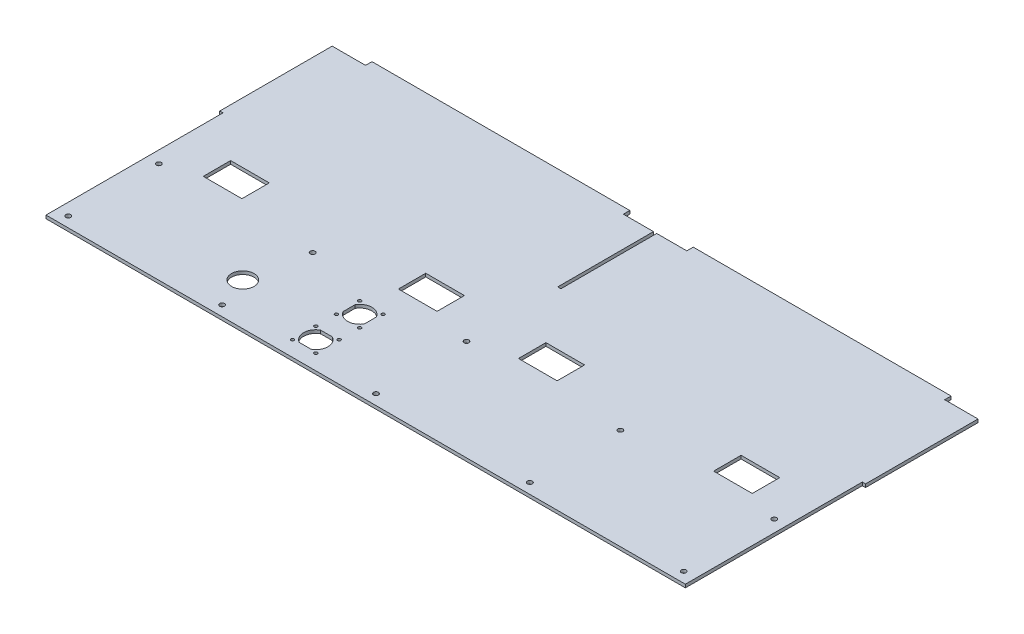
from build123d import *

# Parameters (mm, degrees)
SKETCH1_W            = 629.90984
SKETCH1_H            = 147.69846
BOSS_EXTRUDE1_DEPTH  = 3.175
SKETCH3_W            = 254
SKETCH3_H            = 3.175
BOSS_EXTRUDE2_DEPTH  = 6.35
SKETCH4_W            = 3.175
SKETCH4_H            = 188.732840052
CUT_EXTRUDE1_DEPTH   = 3.175
SKETCH6_W            = 3.175
SKETCH6_H            = 110.773845
BOSS_EXTRUDE4_DEPTH  = 3.175
SKETCH8_W            = 629.90984
SKETCH8_H            = 18.04416
BOSS_EXTRUDE5_DEPTH  = 3.175
SKETCH10_W           = 38.1
SKETCH10_H           = 18.04416
SKETCH10_H_2         = 36.08832
CUT_EXTRUDE3_DEPTH   = 652.56536379
BOSS_EXTRUDE6_DEPTH  = 3.175
SKETCH13_R           = 1.55
SKETCH13_R_2         = 11.049
CUT_EXTRUDE4_DEPTH   = 652.56536379
M4_CLEARANCE_HOLE1_D = 4.8


with BuildPart() as part:
    # Sketch1 → Boss-Extrude1 (new body)
    with BuildSketch(Plane(origin=(0, 0, 0), x_dir=(1, 0, 0), z_dir=(0, 1, 0))):
        with Locations((314.95492, 73.84923)):
            Rectangle(SKETCH1_W, SKETCH1_H)
    extrude(amount=BOSS_EXTRUDE1_DEPTH)

    # Sketch3 → Boss-Extrude2 (add)
    with BuildSketch(Plane(origin=(0, 0, -147.69846), x_dir=(-1, 0, 0), z_dir=(0, 0, -1))):
        with Locations((-473.22613, 1.5875)):
            Rectangle(SKETCH3_W, SKETCH3_H)
        with Locations((-156.68371, 1.5875)):
            Rectangle(SKETCH3_W, SKETCH3_H)
    extrude(amount=BOSS_EXTRUDE2_DEPTH)

    # Sketch4 → Cut-Extrude1 (cut)
    with BuildSketch(Plane(origin=(0, 3.175, 0), x_dir=(1, 0, 0), z_dir=(0, 1, 0))):
        with Locations((314.95492, 147.69846)):
            Rectangle(SKETCH4_W, SKETCH4_H)
    extrude(amount=-CUT_EXTRUDE1_DEPTH, mode=Mode.SUBTRACT)

    # Sketch6 → Boss-Extrude4 (add)
    with BuildSketch(Plane(origin=(0, 3.175, 0), x_dir=(1, 0, 0), z_dir=(0, 1, 0))):
        with Locations((631.49734, 92.3115375)):
            Rectangle(SKETCH6_W, SKETCH6_H)
        with Locations((-1.5875, 92.3115375)):
            Rectangle(SKETCH6_W, SKETCH6_H)
    extrude(amount=-BOSS_EXTRUDE4_DEPTH)

    # Sketch8 → Boss-Extrude5 (add, through all)
    with BuildSketch(Plane(origin=(0, 3.175, 0), x_dir=(1, 0, 0), z_dir=(0, 1, 0))):
        with Locations((314.95492, -9.02208)):
            Rectangle(SKETCH8_W, SKETCH8_H)
    extrude(amount=-BOSS_EXTRUDE5_DEPTH)

    # Sketch10 → Cut-Extrude3 (cut, through all)
    with BuildSketch(Plane(origin=(0, 3.175, 0), x_dir=(1, 0, 0), z_dir=(0, 1, 0))):
        with Locations((374.1674, -9.02208)):
            Rectangle(SKETCH10_W, SKETCH10_H)
        with Locations((255.74244, -9.02208)):
            Rectangle(SKETCH10_W, SKETCH10_H)
        with Locations((566.40984, -18.04416)):
            Rectangle(SKETCH10_W, SKETCH10_H_2)
        with Locations((63.5, -18.04416)):
            Rectangle(SKETCH10_W, SKETCH10_H_2)
    extrude(amount=-CUT_EXTRUDE3_DEPTH, mode=Mode.SUBTRACT)

    # Sketch11 → Boss-Extrude6 (add, through all)
    with BuildSketch(Plane(origin=(0, 3.175, 0), x_dir=(1, 0, 0), z_dir=(0, 1, 0))):
        Polygon((0, -18.04416), (0, -137.42416), (629.90984, -137.42416), (629.90984, -18.04416), (585.45984, -18.04416), (585.45984, -27.06624), (547.35984, -27.06624), (547.35984, -18.04416), (393.2174, -18.04416), (393.2174, -27.06624), (355.1174, -27.06624), (355.1174, -18.04416), (274.79244, -18.04416), (274.79244, -26.95194), (236.69244, -26.95194), (236.69244, -18.04416), (82.55, -18.04416), (82.55, -26.95194), (44.45, -26.95194), (44.45, -18.04416), align=None)
    extrude(amount=-BOSS_EXTRUDE6_DEPTH)

    # Sketch13 → Cut-Extrude4 (cut, through all)
    with BuildSketch(Plane.XZ):
        with Locations(Location((227.731580951, 122.331796051, 0), (0, 0, 270))):
            Circle(SKETCH13_R)
        with Locations(Location((250.731580951, 122.331796051, 0), (0, 0, 270))):
            Circle(SKETCH13_R)
        with Locations(Location((227.731580951, 99.331796051, 0), (0, 0, 270))):
            Circle(SKETCH13_R)
        with Locations(Location((250.731580951, 99.331796051, 0), (0, 0, 270))):
            Circle(SKETCH13_R)
        with Locations(Location((152.328523542, 95.877856055, 0), (0, 0, 270))):
            Circle(SKETCH13_R_2)
        with Locations(Location((227.731580951, 79.083184621, 0), (0, 0, 270))):
            Circle(SKETCH13_R)
        with Locations(Location((227.731580951, 56.083184621, 0), (0, 0, 270))):
            Circle(SKETCH13_R)
        with Locations(Location((250.731580951, 56.083184621, 0), (0, 0, 270))):
            Circle(SKETCH13_R)
        with Locations(Location((250.731580951, 79.083184621, 0), (0, 0, 270))):
            Circle(SKETCH13_R)
        with BuildLine():
            Line((245.043121195, 100.323796051), (233.420040708, 100.323796051))
            ThreePointArc((233.420040708, 100.323796051), (227.223580951, 110.831796051), (233.420040708, 121.339796051))
            Line((233.420040708, 121.339796051), (245.043121195, 121.339796051))
            ThreePointArc((245.043121195, 121.339796051), (251.239580951, 110.831796051), (245.043121195, 100.323796051))
        make_face()
        with BuildLine():
            Line((249.739580951, 73.394724865), (249.739580951, 61.771644378))
            ThreePointArc((249.739580951, 61.771644378), (239.231580951, 55.575184621), (228.723580951, 61.771644378))
            Line((228.723580951, 61.771644378), (228.723580951, 73.394724865))
            ThreePointArc((228.723580951, 73.394724865), (239.231580951, 79.591184621), (249.739580951, 73.394724865))
        make_face()
    extrude(amount=-CUT_EXTRUDE4_DEPTH, mode=Mode.SUBTRACT)

    # M4 Clearance Hole1 (through all)
    with Locations(Plane(origin=(0, 0, 0), x_dir=(-1, 0, 0), z_dir=(0, -1, 0))):
        with Locations((-618.09884, -38.11016), (-466.52688, -38.11016), (-618.09884, -127.26416), (-466.52688, -127.26416), (-314.95492, -127.26416), (-314.95492, -38.11016), (-163.38296, -38.11016), (-11.811, -38.11016), (-11.811, -127.26416), (-163.38296, -127.26416)):
            Hole(M4_CLEARANCE_HOLE1_D / 2)


solid = part.part
